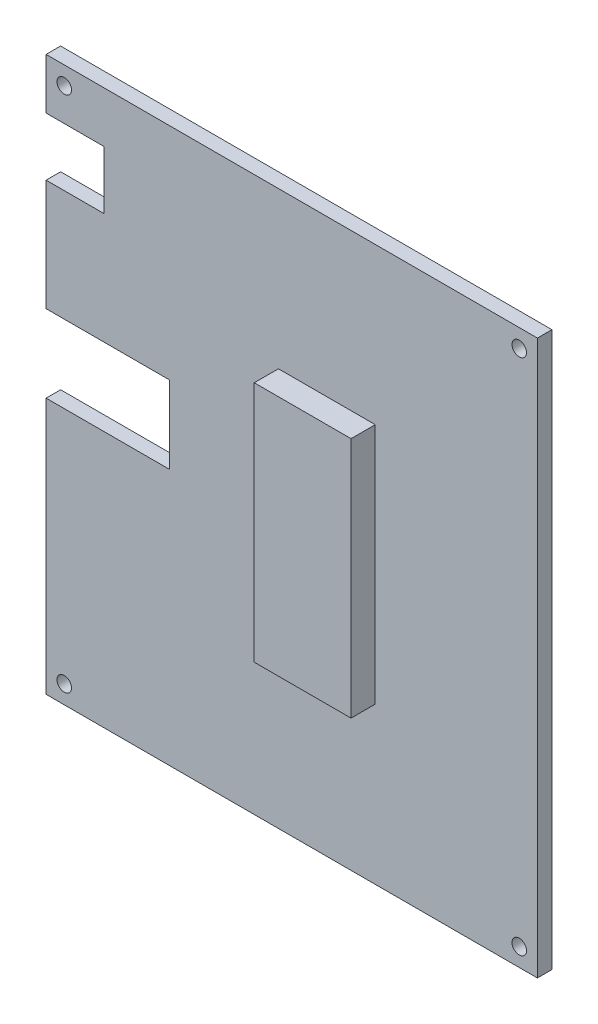
from build123d import *

# Parameters (mm, degrees)
SKETCH1_R           = 1.5
BOSS_EXTRUDE1_DEPTH = 3
SKETCH2_W           = 20
SKETCH2_H           = 50
BOSS_EXTRUDE2_DEPTH = 8


with BuildPart() as part:
    # Sketch1 → Boss-Extrude1 (new body)
    with BuildSketch(Plane(origin=(0, 0, 0), x_dir=(-1, 0, 0), z_dir=(0, 0, 1))):
        Polygon((50.75, 10.25), (50.75, 48.25), (50.75, 57.25), (-50.75, 57.25), (-50.75, -14.25), (-50.75, -41.25), (-50.75, -57.25), (-43.25, -57.25), (29.75, -57.25), (50.75, -57.25), (50.75, -46.75), (38.75, -46.75), (38.75, -34.75), (50.75, -34.75), (50.75, -29.75), (50.75, -20.75), (50.75, -11.75), (25.25, -11.75), (25.25, 4.25), (50.75, 4.25), align=None)
        with Locations(Location((-47, -53.5, 0), (0, 0, 180))):
            Circle(SKETCH1_R, mode=Mode.SUBTRACT)
        with Locations(Location((-47, 53.5, 0), (0, 0, 180))):
            Circle(SKETCH1_R, mode=Mode.SUBTRACT)
        with Locations(Location((47, 53.5, 0), (0, 0, 180))):
            Circle(SKETCH1_R, mode=Mode.SUBTRACT)
        with Locations(Location((47, -53.5, 0), (0, 0, 180))):
            Circle(SKETCH1_R, mode=Mode.SUBTRACT)
    extrude(amount=BOSS_EXTRUDE1_DEPTH)

    # Sketch2 → Boss-Extrude2 (add)
    with BuildSketch(Plane(origin=(0, 0, 0), x_dir=(-1, 0, 0), z_dir=(0, 0, -1))):
        with Locations((-7.252332969, 0)):
            Rectangle(SKETCH2_W, SKETCH2_H)
    extrude(amount=-BOSS_EXTRUDE2_DEPTH)


solid = part.part
